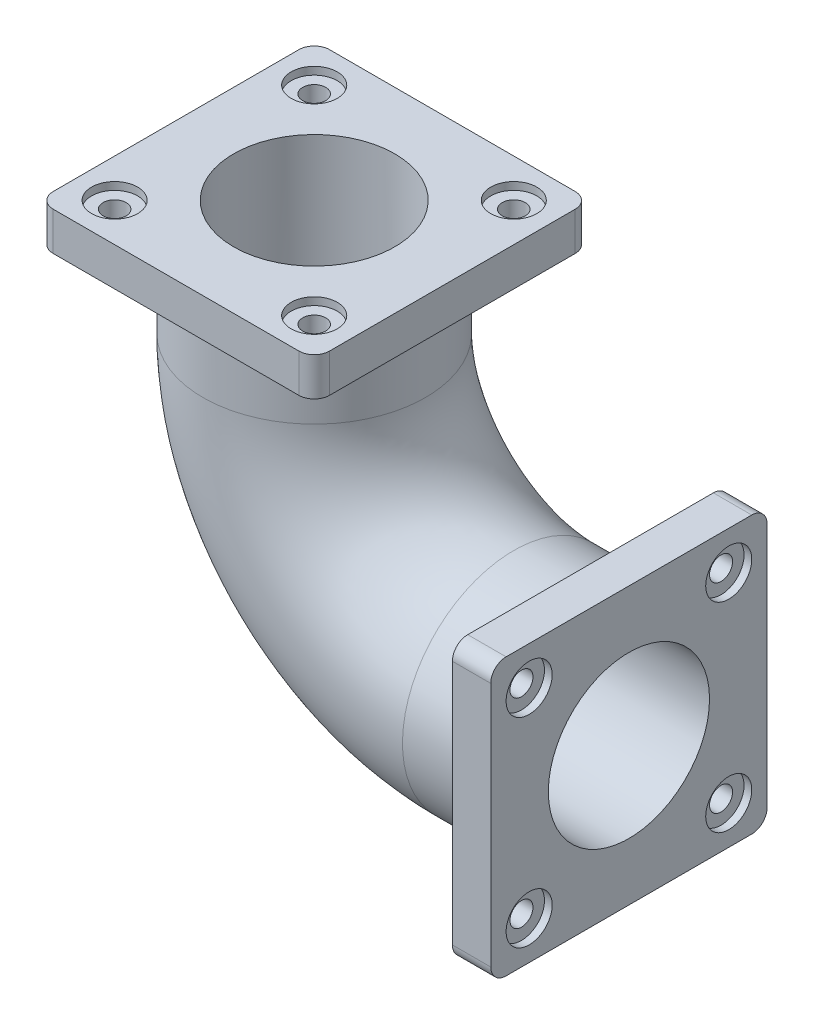
from build123d import *

# Parameters (mm, degrees)
SKETCH3_R            = 145
SKETCH3_R_2          = 105
SKETCH5_W            = 360
SKETCH5_H            = 360
BOSS_EXTRUDE1_DEPTH  = 50
SKETCH6_R            = 105
CUT_EXTRUDE1_DEPTH   = 50
FILLET1_R            = 20
SKETCH7_R            = 15
CUT_EXTRUDE4_DEPTH   = 50
SKETCH9_R            = 30
CUT_EXTRUDE5_DEPTH   = 10
FILLET1_OF_MIRROR3_R = 20


with BuildPart() as part:
    # Sweep1: sweep along a path in Sketch1
    with BuildLine(Plane.XY) as sweep1_path:
        Line((0, 0), (-150, 0))
        ThreePointArc((-150, 0), (-333.847763109, 76.152236891), (-410, 260))
        Line((-410, 260), (-410, 410))
    # Sketch3 → Sweep1 (sweep)
    with BuildSketch(Plane(origin=(0, 410, 0), x_dir=(1, 0, 0), z_dir=(0, 1, 0))):
        with Locations((-410, 0)):
            Circle(SKETCH3_R)
        with Locations((-410, 0)):
            Circle(SKETCH3_R_2, mode=Mode.SUBTRACT)
    sweep(path=sweep1_path.line)

    # Sketch5 → Boss-Extrude1 (add)
    with BuildSketch(Plane(origin=(0, 410, 0), x_dir=(1, 0, 0), z_dir=(0, 1, 0))):
        with Locations((-410, 0)):
            Rectangle(SKETCH5_W, SKETCH5_H)
    boss_extrude1 = extrude(amount=-BOSS_EXTRUDE1_DEPTH)

    # Sketch6 → Cut-Extrude1 (cut)
    with BuildSketch(Plane(origin=(0, 410, 0), x_dir=(1, 0, 0), z_dir=(0, 1, 0))):
        with Locations(Location((-410, 0, 0), (0, 0, 270))):
            Circle(SKETCH6_R)
    cut_extrude1 = extrude(amount=-CUT_EXTRUDE1_DEPTH, mode=Mode.SUBTRACT)

    # Fillet1
    fillet1_edges = [part.edges().sort_by_distance(p)[0] for p in [
        (-590, 385, 180),
        (-590, 385, -180),
        (-230, 385, -180),
        (-230, 385, 180),
    ]]
    fillet(fillet1_edges, radius=FILLET1_R)

    # Sketch7 → Cut-Extrude4 (cut)
    with BuildSketch(Plane(origin=(0, 410, 0), x_dir=(1, 0, 0), z_dir=(0, 1, 0))):
        with Locations(Location((-540, 130, 0), (0, 0, 270))):
            Circle(SKETCH7_R)
        with Locations(Location((-280, 130, 0), (0, 0, 90))):
            Circle(SKETCH7_R)
        with Locations(Location((-280, -130, 0), (0, 0, 270))):
            Circle(SKETCH7_R)
        with Locations(Location((-540, -130, 0), (0, 0, 90))):
            Circle(SKETCH7_R)
    cut_extrude4 = extrude(amount=-CUT_EXTRUDE4_DEPTH, mode=Mode.SUBTRACT)

    # Sketch9 → Cut-Extrude5 (cut)
    with BuildSketch(Plane(origin=(0, 410, 0), x_dir=(1, 0, 0), z_dir=(0, 1, 0))):
        with Locations(Location((-540, -130, 0), (0, 0, 270))):
            Circle(SKETCH9_R)
        with Locations(Location((-280, -130, 0), (0, 0, 270))):
            Circle(SKETCH9_R)
        with Locations(Location((-540, 130, 0), (0, 0, 270))):
            Circle(SKETCH9_R)
        with Locations(Location((-280, 130, 0), (0, 0, 270))):
            Circle(SKETCH9_R)
    cut_extrude5 = extrude(amount=-CUT_EXTRUDE5_DEPTH, mode=Mode.SUBTRACT)

    # Mirror3: Boss-Extrude1, Cut-Extrude1, Cut-Extrude4, Cut-Extrude5 across plane
    add(boss_extrude1.mirror(Plane(origin=(-205, 205, 0), x_dir=(0, 0, 1), z_dir=(-0.7071067811865475, 0.7071067811865477, 0))))
    add(cut_extrude1.mirror(Plane(origin=(-205, 205, 0), x_dir=(0, 0, 1), z_dir=(-0.7071067811865475, 0.7071067811865477, 0))), mode=Mode.SUBTRACT)
    add(cut_extrude4.mirror(Plane(origin=(-205, 205, 0), x_dir=(0, 0, 1), z_dir=(-0.7071067811865475, 0.7071067811865477, 0))), mode=Mode.SUBTRACT)
    add(cut_extrude5.mirror(Plane(origin=(-205, 205, 0), x_dir=(0, 0, 1), z_dir=(-0.7071067811865475, 0.7071067811865477, 0))), mode=Mode.SUBTRACT)

    # Fillet1 of Mirror3
    fillet1_of_mirror3_edges = [part.edges().sort_by_distance(p)[0] for p in [
        (-25, -180, 180),
        (-25, -180, -180),
        (-25, 180, -180),
        (-25, 180, 180),
    ]]
    fillet(fillet1_of_mirror3_edges, radius=FILLET1_OF_MIRROR3_R)


solid = part.part
